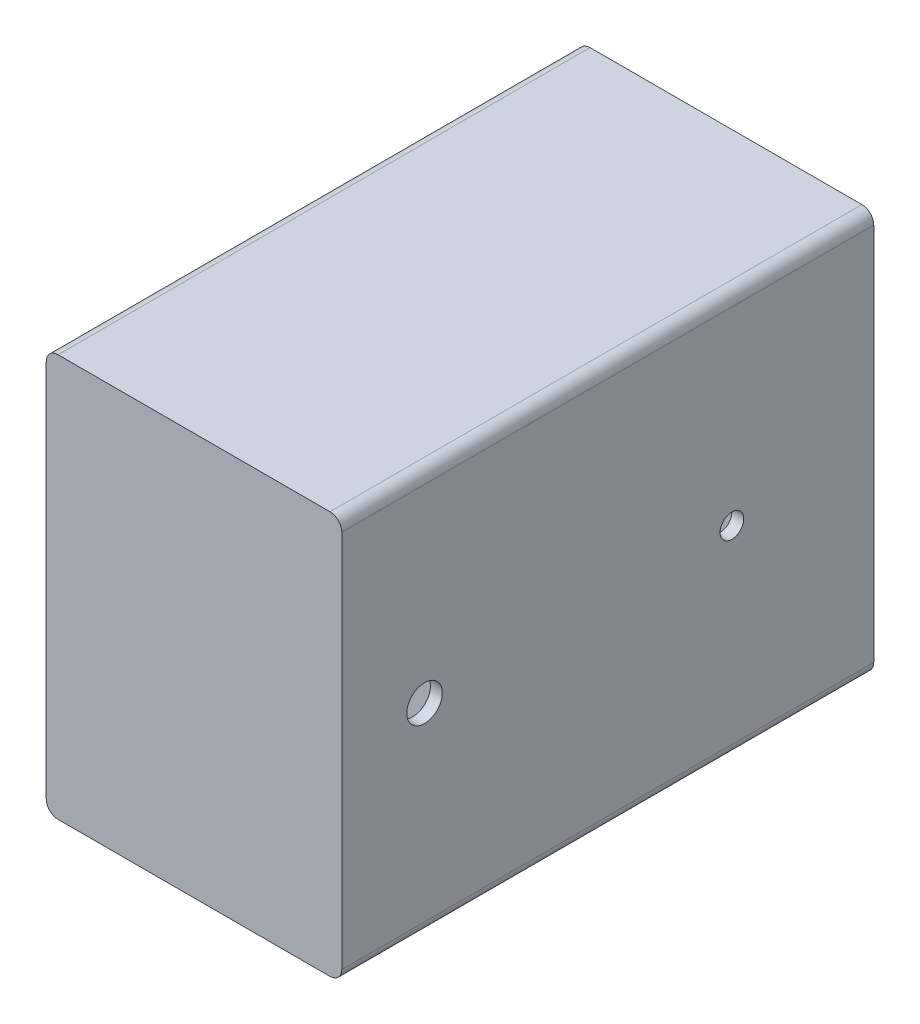
from build123d import *

# Parameters (mm, degrees)
SKETCH_1_W          = 250
SKETCH_1_H          = 340.4
EXTRUDE_1_DEPTH     = 450
FILLET_1_R          = 10
SKETCH_4_R          = 10
CUT_EXTRUDE_1_DEPTH = 50
CUT_EXTRUDE_2_DEPTH = 1
CUT_EXTRUDE_START   = -5
CUT_EXTRUDE_3_DEPTH = 440
SKETCH_8_R          = 15
CUT_EXTRUDE_4_DEPTH = 543.188196109
EXTRUDE_START       = -5
SKETCH_11_W         = 8
SKETCH_11_H         = 320.4
EXTRUDE_2_DEPTH     = 235


with BuildPart() as part:
    # 草图1 → 凸台-拉伸1 (new body)
    with BuildSketch(Plane.XY):
        Rectangle(SKETCH_1_W, SKETCH_1_H)
    extrude(amount=EXTRUDE_1_DEPTH)

    # 圆角1
    fillet_1_edges = [part.edges().sort_by_distance(p)[0] for p in [
        (125, -170.2, 225),
        (-125, -170.2, 225),
        (-125, 170.2, 225),
        (125, 170.2, 225),
    ]]
    fillet(fillet_1_edges, radius=FILLET_1_R)

    # 草图4 → 切除-拉伸1 (cut)
    with BuildSketch(Plane(origin=(125, 0, 0), x_dir=(0, 0, -1), z_dir=(1, 0, 0))):
        with Locations(Location((-120, 0, 0), (0, 0, 270))):
            Circle(SKETCH_4_R)
    extrude(amount=-CUT_EXTRUDE_1_DEPTH, mode=Mode.SUBTRACT)

    # 草图5 → 切除-拉伸2 (cut)
    with BuildSketch(Plane(origin=(0, 0, 0), x_dir=(-1, 0, 0), z_dir=(0, 0, -1))):
        with BuildLine():
            Line((-30.5, -35.5), (30.5, -35.5))
            ThreePointArc((30.5, -35.5), (37.571067812, -32.571067812), (40.5, -25.5))
            Line((40.5, -25.5), (40.5, 25.5))
            ThreePointArc((40.5, 25.5), (37.571067812, 32.571067812), (30.5, 35.5))
            Line((30.5, 35.5), (-30.5, 35.5))
            ThreePointArc((-30.5, 35.5), (-37.571067812, 32.571067812), (-40.5, 25.5))
            Line((-40.5, 25.5), (-40.5, -25.5))
            ThreePointArc((-40.5, -25.5), (-37.571067812, -32.571067812), (-30.5, -35.5))
        make_face()
    extrude(amount=-CUT_EXTRUDE_2_DEPTH, mode=Mode.SUBTRACT)

    # 草图7 → 切除-拉伸3 (cut)
    with BuildSketch(Plane.XY.offset(450).offset(CUT_EXTRUDE_START)):
        Polygon((-120, -160.2), (-120, 160.2), (115, 160.2), (115, -160.2), (-18.295526733, -160.2), align=None)
    extrude(amount=-CUT_EXTRUDE_3_DEPTH, mode=Mode.SUBTRACT)

    # 草图8 → 切除-拉伸4 (cut, through all)
    with BuildSketch(Plane.ZY.offset(125)):
        with Locations(Location((380, 0, 0), (0, 0, 270))):
            Circle(SKETCH_8_R)
    extrude(amount=-CUT_EXTRUDE_4_DEPTH, mode=Mode.SUBTRACT)

    # 草图11 → 凸台-拉伸2 (add)
    with BuildSketch(Plane(origin=(125, 0, 0), x_dir=(0, 0, -1), z_dir=(1, 0, 0)).offset(EXTRUDE_START)):
        with Locations((-326, 0)):
            Rectangle(SKETCH_11_W, SKETCH_11_H)
    extrude(amount=-EXTRUDE_2_DEPTH)


solid = part.part
